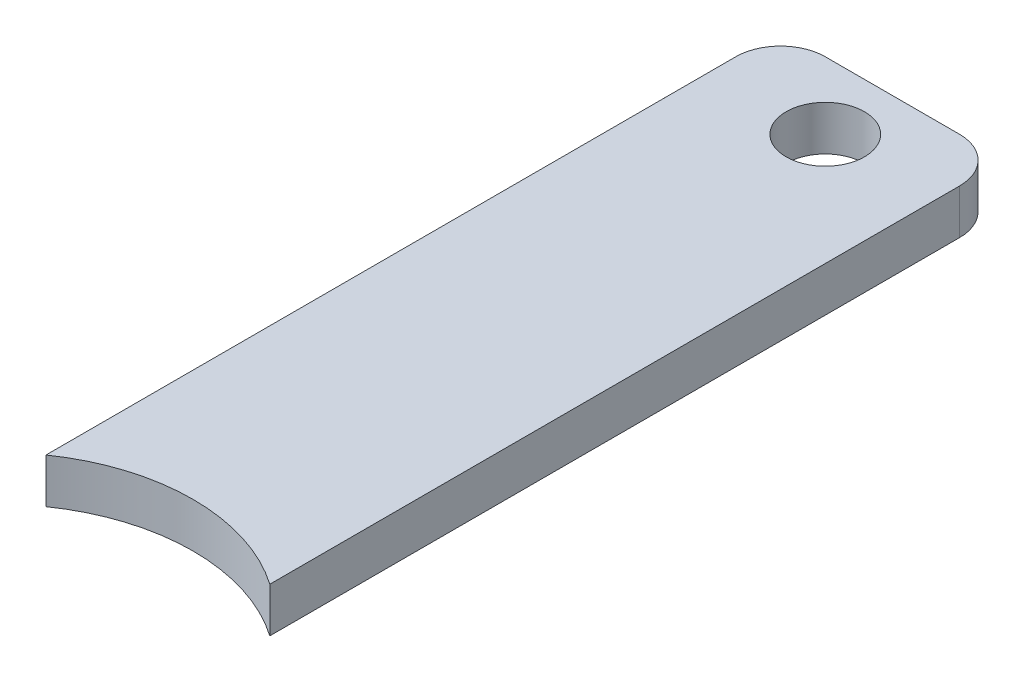
from build123d import *

# Parameters (mm, degrees)
SKETCH1_R           = 3.5
BOSS_EXTRUDE1_DEPTH = 4


with BuildPart() as part:
    # Sketch1 → Boss-Extrude1 (new body)
    with BuildSketch(Plane(origin=(0, 0, 0), x_dir=(1, 0, 0), z_dir=(0, 1, 0))):
        with BuildLine():
            Line((-10, 14.361406616), (-10, 76))
            ThreePointArc((-10, 76), (-8.828427125, 78.828427125), (-6, 80))
            Line((-6, 80), (6, 80))
            ThreePointArc((6, 80), (8.828427125, 78.828427125), (10, 76))
            Line((10, 76), (10, 14.361406616))
            ThreePointArc((10, 14.361406616), (0, 17.5), (-10, 14.361406616))
        make_face()
        with Locations(Location((0, 74, 0), (0, 0, 270))):
            Circle(SKETCH1_R, mode=Mode.SUBTRACT)
    extrude(amount=BOSS_EXTRUDE1_DEPTH)


solid = part.part
